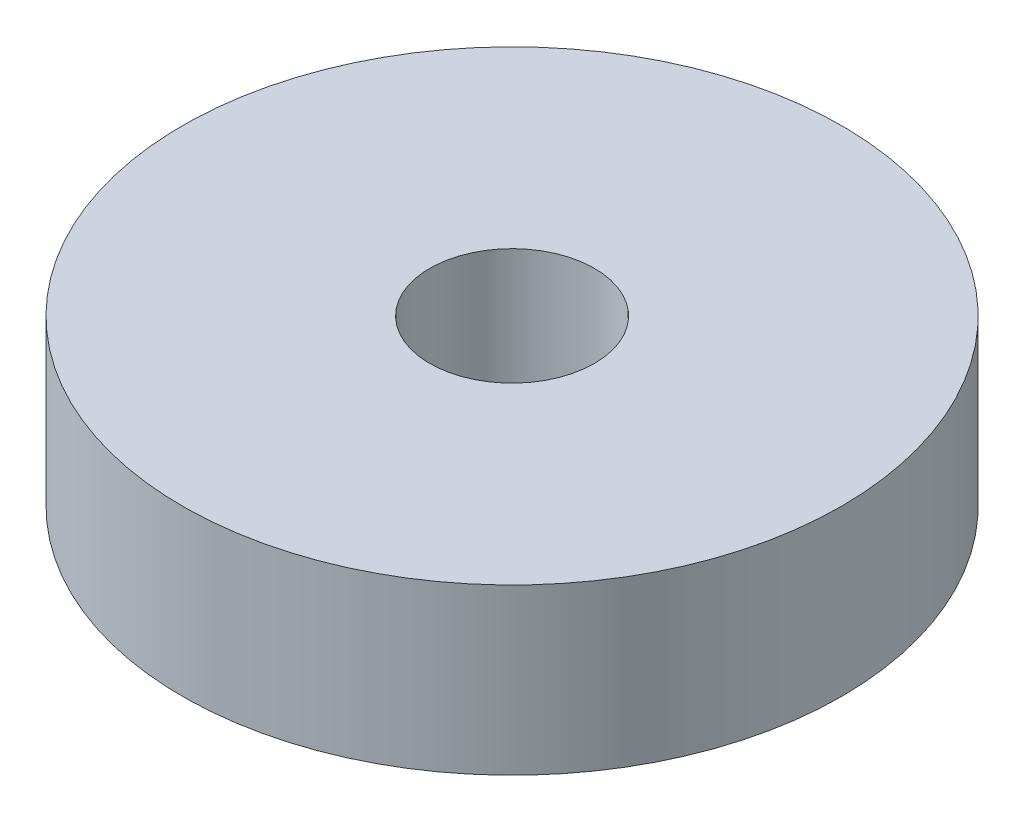
from build123d import *

# Parameters (mm, degrees)
SKETCH_1_W = 4.5
SKETCH_1_H = 3


with BuildPart() as part:
    # 草图1 → 旋转1 (revolve)
    with BuildSketch(Plane.XY):
        with Locations((3.75, 0)):
            Rectangle(SKETCH_1_W, SKETCH_1_H)
    revolve(axis=Axis((0, -110.303526969, 0), (0, 1, 0)))


solid = part.part
